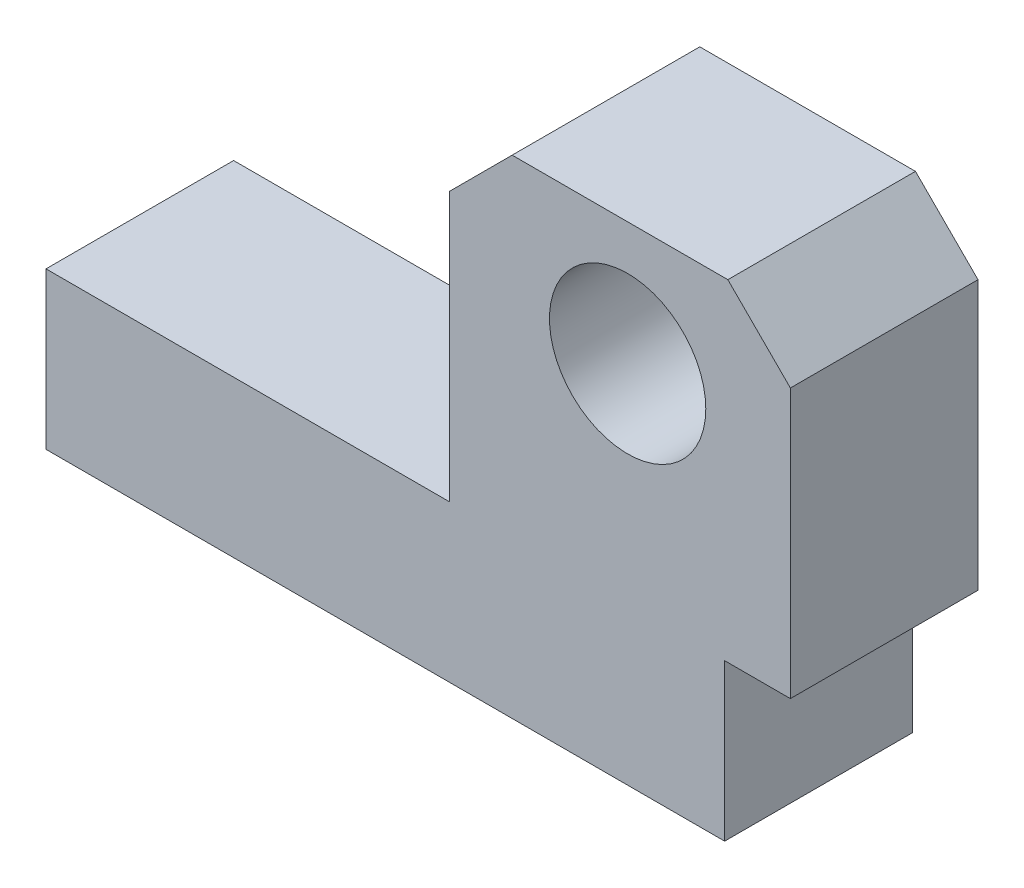
from build123d import *

# Parameters (mm, degrees)
SKETCH_1_R      = 2.5
EXTRUDE_1_DEPTH = 6


with BuildPart() as part:
    # Эскиз1 → Вытянуть1 (new body)
    with BuildSketch(Plane.XY):
        Polygon((-4.730404232, 5), (8.177314087, 5), (8.177314087, 13.602978753), (10.177314087, 15.602978753), (17.075283444, 15.602978753), (19.075283444, 13.602978753), (19.075283444, 5), (16.972741992, 5), (16.972741992, 0), (-4.730404232, 0), align=None)
        with Locations((13.870306462, 11.674196646)):
            Circle(SKETCH_1_R, mode=Mode.SUBTRACT)
    extrude(amount=EXTRUDE_1_DEPTH)


solid = part.part
